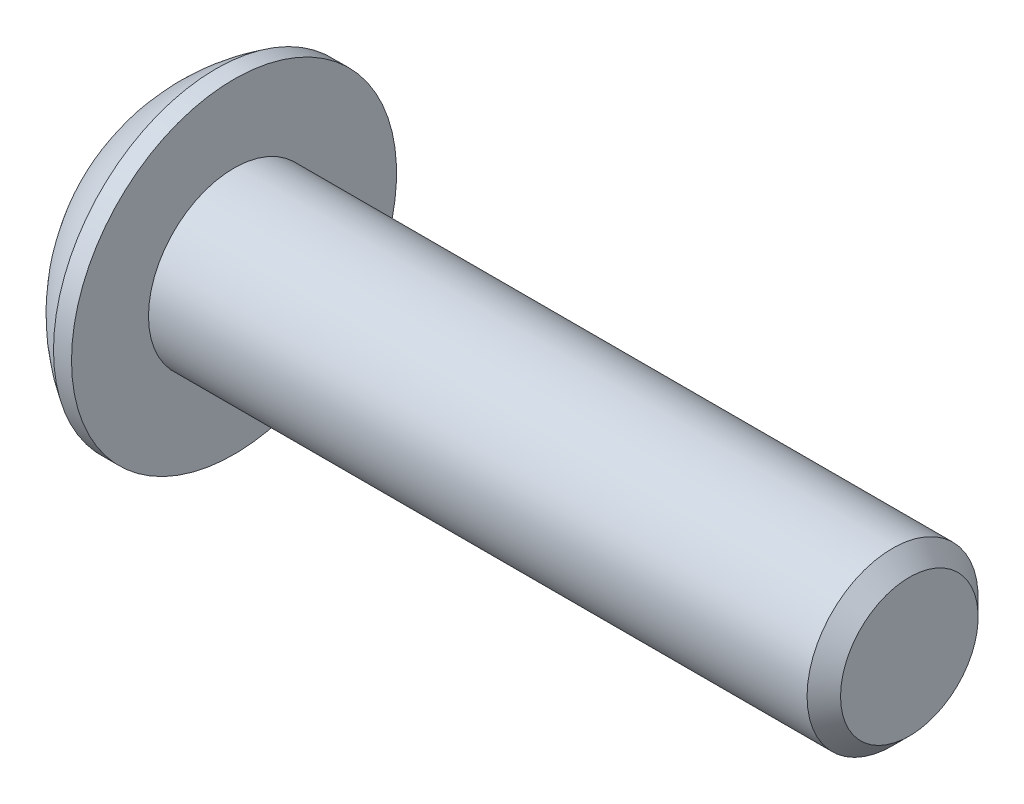
from build123d import *

# Parameters (mm, degrees)
HEX_2_DEPTH = 1.778


with BuildPart() as part:
    # BodySke → BaseBody (revolve)
    with BuildSketch(Plane.XY, mode=Mode.PRIVATE) as basebody_sk:
        with BuildLine():
            Line((21.6154, 0), (21.6154, 1.94056))
            Line((21.6154, 1.94056), (21.14296, 2.413))
            Line((21.14296, 2.413), (2.5654, 2.413))
            Line((2.5654, 2.413), (2.5654, 4.5847))
            Line((2.5654, 4.5847), (2.0574, 4.5847))
            ThreePointArc((2.0574, 4.5847), (0.860923645, 3.589105441), (0, 2.29235))
            Line((0, 2.29235), (0, 0))
            Line((0, 0), (21.6154, 0))
        make_face()
    revolve(basebody_sk.sketch.rotate(Axis((0, 0, 0), (1, 0, 0)), 90), axis=Axis((0, 0, 0), (1, 0, 0)))

    # Sketch2 → PreBroach (revolve, cut)
    with BuildSketch(Plane.XY, mode=Mode.PRIVATE) as prebroach_sk:
        Polygon((0, 1.5875), (1.778, 1.5875), (2.694543552, 0), (0, 0), align=None)
    revolve(prebroach_sk.sketch.rotate(Axis((0, 0, 0), (1, 0, 0)), 90), axis=Axis((0, 0, 0), (1, 0, 0)), mode=Mode.SUBTRACT)

    # Sketch3 → Hex 2 (cut)
    with BuildSketch(Plane(origin=(0, 0, 0), x_dir=(0, 0, -1), z_dir=(1, 0, 0))):
        Polygon((-1.5875, -0.916543552), (-1.5875, 0.916543552), (0, 1.833087105), (1.5875, 0.916543552), (1.5875, -0.916543552), (0, -1.833087105), align=None)
    extrude(amount=HEX_2_DEPTH, mode=Mode.SUBTRACT)


solid = part.part
